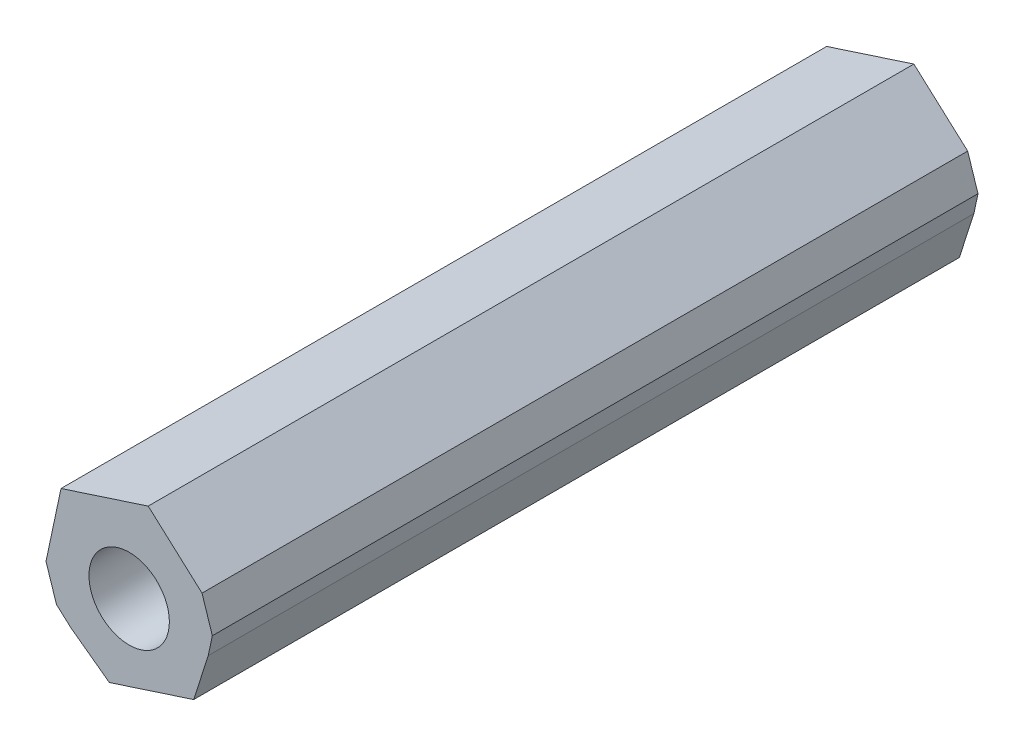
from build123d import *

# Parameters (mm, degrees)
SKETCH_2_R      = 1.25
EXTRUDE_1_DEPTH = 23.8


with BuildPart() as part:
    # 草图2 → 凸台-拉伸1 (new body)
    with BuildSketch(Plane.XY):
        Polygon((-0.615744096, -2.565833968), (2.006251414, -1.713942825), (2.458717944, -0.303911724), (2.585925156, 0.294503607), (2.265203695, 1.281637041), (0.592593365, 2.787711087), (-2.117931937, 1.907056452), (-2.584621623, -0.288371455), (-2.260544862, -1.28583201), (-1.810564422, -1.691009384), align=None)
        Circle(SKETCH_2_R, mode=Mode.SUBTRACT)
    extrude(amount=EXTRUDE_1_DEPTH)


solid = part.part
